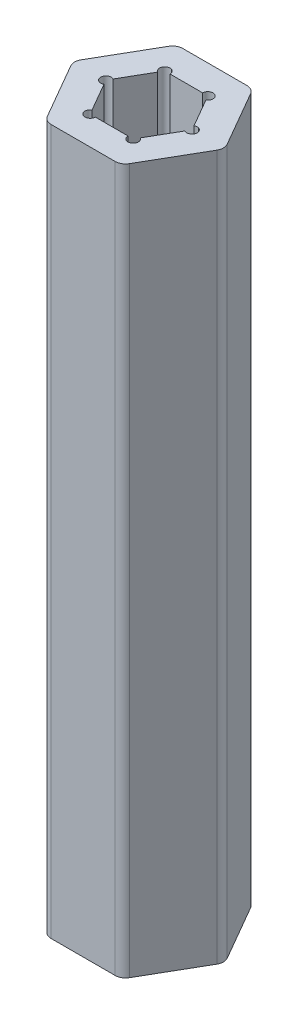
from build123d import *

# Parameters (mm, degrees)
BOSS_EXTRUDE1_DEPTH = 68
SKETCH2_R           = 0.5
CUT_EXTRUDE1_DEPTH  = 69.68832385
FILLET1_R           = 1


with BuildPart() as part:
    # Sketch1 → Boss-Extrude1 (new body)
    with BuildSketch(Plane(origin=(0, 0, 0), x_dir=(1, 0, 0), z_dir=(0, 1, 0))):
        Polygon((3.666174209, 6.35), (-3.666174209, 6.35), (-7.332348419, 0), (-3.666174209, -6.35), (3.666174209, -6.35), (7.332348419, 0), align=None)
        Polygon((2.078460969, 3.6), (-2.078460969, 3.6), (-4.156921938, 0), (-2.078460969, -3.6), (2.078460969, -3.6), (4.156921938, 0), align=None, mode=Mode.SUBTRACT)
    extrude(amount=BOSS_EXTRUDE1_DEPTH)

    # Sketch2 → Cut-Extrude1 (cut, through all)
    with BuildSketch(Plane(origin=(0, 68, 0), x_dir=(1, 0, 0), z_dir=(0, 1, 0))):
        with Locations((-2.078460969, 3.6)):
            Circle(SKETCH2_R)
        with Locations((2.078460969, 3.6)):
            Circle(SKETCH2_R)
        with Locations((4.156921938, 0)):
            Circle(SKETCH2_R)
        with Locations((2.078460969, -3.6)):
            Circle(SKETCH2_R)
        with Locations((-2.078460969, -3.6)):
            Circle(SKETCH2_R)
        with Locations((-4.156921938, 0)):
            Circle(SKETCH2_R)
    extrude(amount=-CUT_EXTRUDE1_DEPTH, mode=Mode.SUBTRACT)

    # Fillet1
    fillet1_edges = [part.edges().sort_by_distance(p)[0] for p in [
        (7.332348419, 34, 0),
        (3.666174209, 34, 6.35),
        (-3.666174209, 34, 6.35),
        (-7.332348419, 34, 0),
        (-3.666174209, 34, -6.35),
        (3.666174209, 34, -6.35),
    ]]
    fillet(fillet1_edges, radius=FILLET1_R)


solid = part.part
